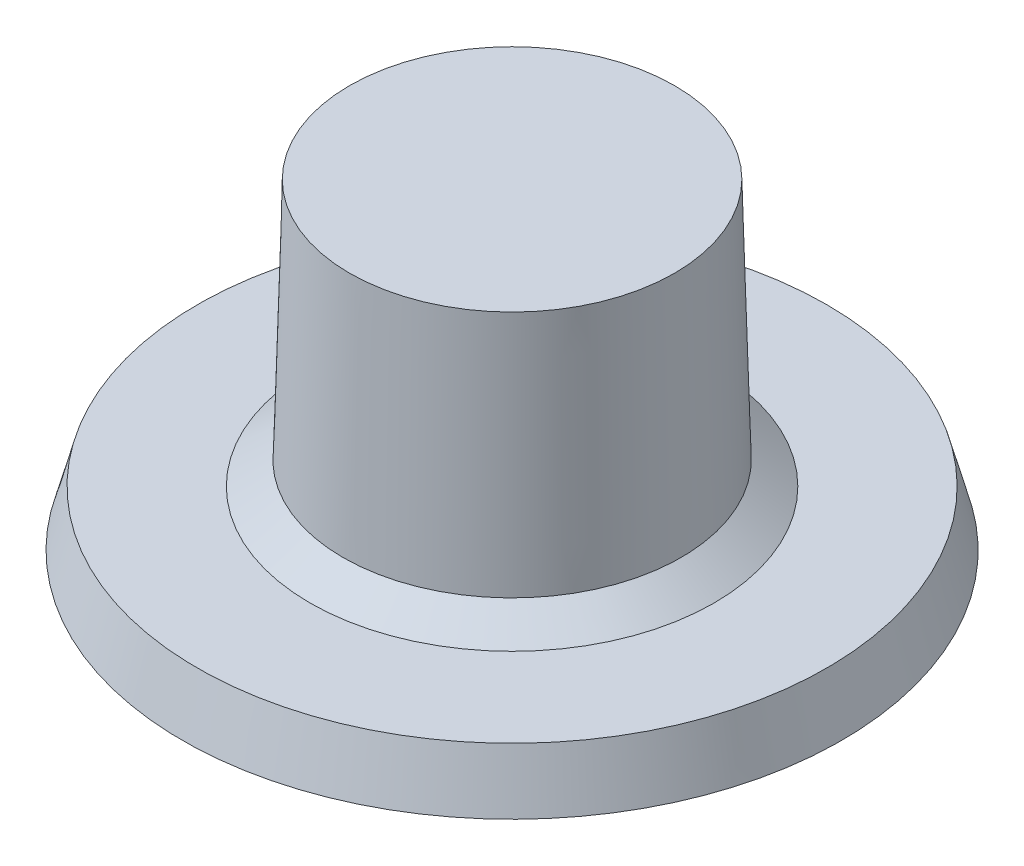
from build123d import *


with BuildPart() as part:
    # Sketch1 → Revolve-Thin1 (revolve)
    with BuildSketch(Plane(origin=(0, 0, 0), x_dir=(0, 0, -1), z_dir=(1, 0, 0)), mode=Mode.PRIVATE) as revolve_thin1_sk:
        Polygon((0, 0), (-82.77987, 0), (-79.050134, 13.891514), (-50.756312, 13.891514), (-42.491914, 19.664934), (-40.819324, 80.659732), (0, 80.659732), (0, 78.119732), (-38.348020684, 78.119732), (-39.987956021, 18.315760551), (-49.9569701, 11.351514), (-77.102141701, 11.351514), (-79.467947256, 2.54), (0, 2.54), align=None)
    revolve(revolve_thin1_sk.sketch.rotate(Axis((0, 0, 0), (0, 1, 0)), 180), axis=Axis((0, 0, 0), (0, 1, 0)))


solid = part.part
